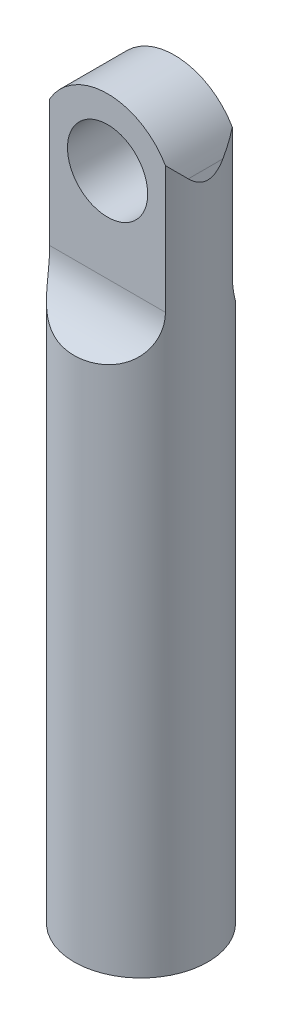
from build123d import *

# Parameters (mm, degrees)
SKETCH1_R               = 5
BOSS_EXTRUDE1_DEPTH     = 55
CUT_EXTRUDE2_DEPTH      = 56.452682532
CUT_EXTRUDE2_DEPTH_BACK = 56.452682532
SKETCH6_R               = 3
CUT_EXTRUDE3_DEPTH      = 56.733742145
CUT_EXTRUDE4_DEPTH      = 56.733742145
CUT_EXTRUDE5_DEPTH      = 6


with BuildPart() as part:
    # Sketch1 → Boss-Extrude1 (new body)
    with BuildSketch(Plane(origin=(0, 0, 0), x_dir=(1, 0, 0), z_dir=(0, 1, 0))):
        with Locations(Location((0, 0, 0), (0, 0, 270))):
            Circle(SKETCH1_R)
    extrude(amount=BOSS_EXTRUDE1_DEPTH)

    # Sketch5 → Cut-Extrude2 (cut, two sides: drawn at the far end of the back side and taken through both)
    with BuildSketch(Plane(origin=(0, 0, 0), x_dir=(0, 0, -1), z_dir=(1, 0, 0)).offset(-CUT_EXTRUDE2_DEPTH_BACK)):
        with BuildLine():
            Line((-2.5, 55), (-2.5, 43))
            ThreePointArc((-2.5, 43), (-3.671572875, 40.171572875), (-6.5, 39))
            Line((-6.5, 39), (-6.5, 55))
            Line((-6.5, 55), (-2.5, 55))
        make_face()
        with BuildLine():
            Line((6.5, 55), (6.5, 39))
            ThreePointArc((6.5, 39), (3.671572875, 40.171572875), (2.5, 43))
            Line((2.5, 43), (2.5, 55))
            Line((2.5, 55), (6.5, 55))
        make_face()
    extrude(amount=CUT_EXTRUDE2_DEPTH + CUT_EXTRUDE2_DEPTH_BACK, mode=Mode.SUBTRACT)

    # Sketch6 → Cut-Extrude3 (cut, through all)
    with BuildSketch(Plane.XY.offset(2.5)):
        with Locations((0, 50)):
            Circle(SKETCH6_R)
    extrude(amount=-CUT_EXTRUDE3_DEPTH, mode=Mode.SUBTRACT)

    # Sketch7 → Cut-Extrude4 (cut, through all)
    with BuildSketch(Plane(origin=(0, 0, -2.5), x_dir=(-1, 0, 0), z_dir=(0, 0, -1))):
        with BuildLine():
            Line((-4.829629131, 51.294095226), (-10.892994719, 28.665306789))
            Line((-10.892994719, 28.665306789), (-10.892994719, 70.083373649))
            Line((-10.892994719, 70.083373649), (10.892994719, 70.083373649))
            Line((10.892994719, 70.083373649), (10.892994719, 28.665306789))
            Line((10.892994719, 28.665306789), (4.829629131, 51.294095226))
            ThreePointArc((4.829629131, 51.294095226), (0, 55), (-4.829629131, 51.294095226))
        make_face()
    extrude(amount=-CUT_EXTRUDE4_DEPTH, mode=Mode.SUBTRACT)

    # Sketch8 → Cut-Extrude5 (cut)
    with BuildSketch(Plane.XZ):
        with BuildLine():
            Line((-1.5, 2), (-1.5, -2))
            ThreePointArc((-1.5, -2), (0, -2.5), (1.5, -2))
            Line((1.5, -2), (1.5, 2))
            ThreePointArc((1.5, 2), (0, 2.5), (-1.5, 2))
        make_face()
    extrude(amount=-CUT_EXTRUDE5_DEPTH, mode=Mode.SUBTRACT)


solid = part.part
